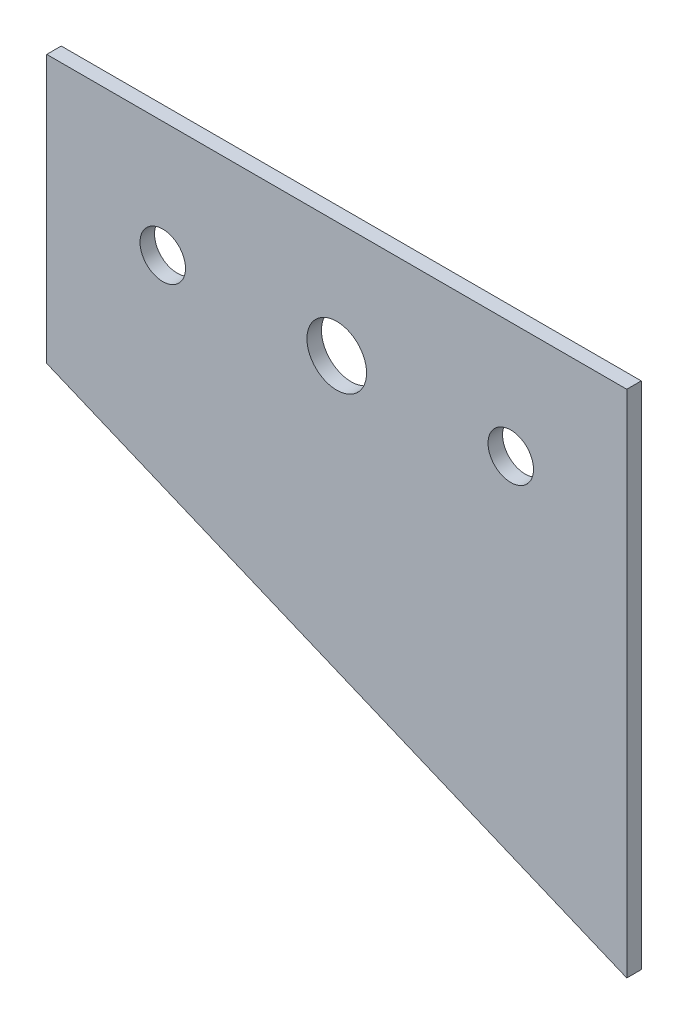
from build123d import *

# Parameters (mm, degrees)
SKETCH1_R           = 2.4892
SKETCH1_R_2         = 3.2639
BOSS_EXTRUDE1_DEPTH = 1.5875


with BuildPart() as part:
    # Sketch1 → Boss-Extrude1 (new body)
    with BuildSketch(Plane.XY):
        Polygon((1461.230443341, -334.611342558), (1461.230443341, -278.791209664), (1397.730443341, -278.791209664), (1397.730443341, -308.095189664), align=None)
        with Locations((1410.430443341, -291.492960492)):
            Circle(SKETCH1_R, mode=Mode.SUBTRACT)
        with Locations((1448.530443341, -291.492960492)):
            Circle(SKETCH1_R, mode=Mode.SUBTRACT)
        with Locations((1429.480443341, -291.492960492)):
            Circle(SKETCH1_R_2, mode=Mode.SUBTRACT)
    extrude(amount=BOSS_EXTRUDE1_DEPTH)


solid = part.part
